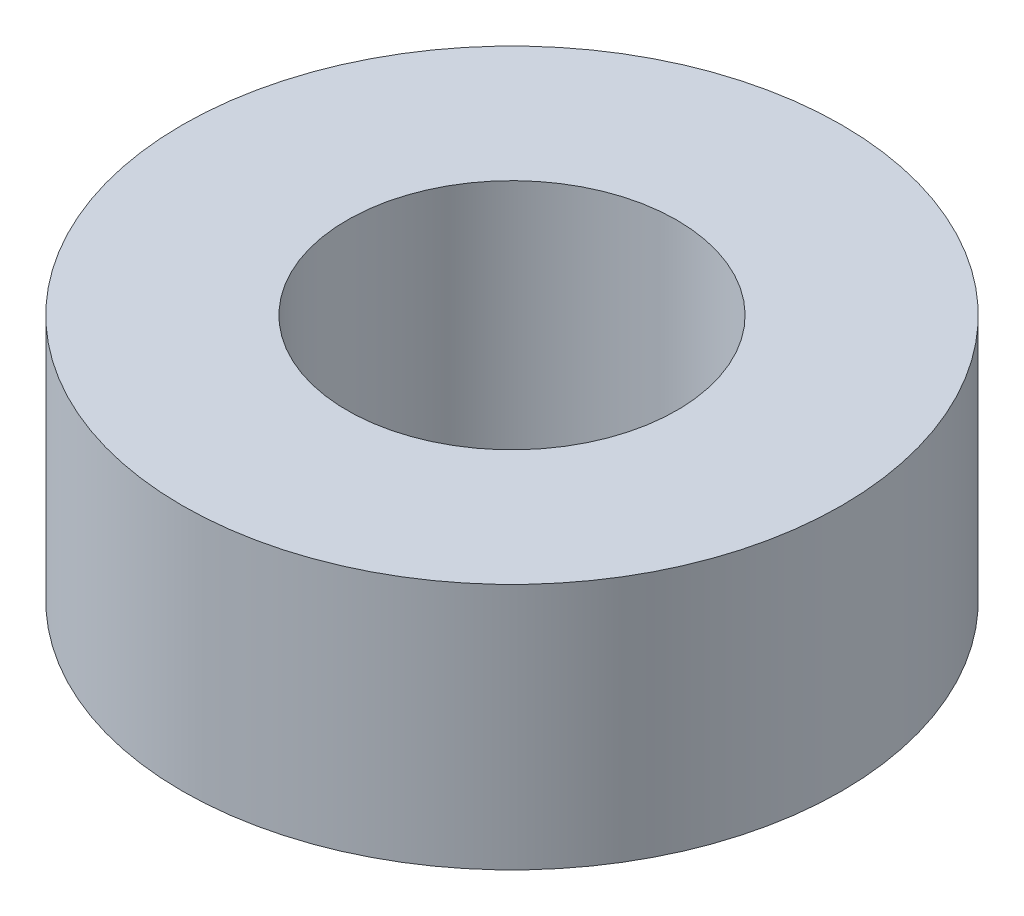
from build123d import *

# Parameters (mm, degrees)
SKETCH1_W = 2
SKETCH1_H = 3


with BuildPart() as part:
    # Sketch1 → Revolve1 (revolve)
    with BuildSketch(Plane.XY, mode=Mode.PRIVATE) as revolve1_sk:
        with Locations((-3, 0)):
            Rectangle(SKETCH1_W, SKETCH1_H)
    revolve(revolve1_sk.sketch.rotate(Axis((0, 0, 0), (0, 1, 0)), 270), axis=Axis((0, 0, 0), (0, 1, 0)))


solid = part.part
